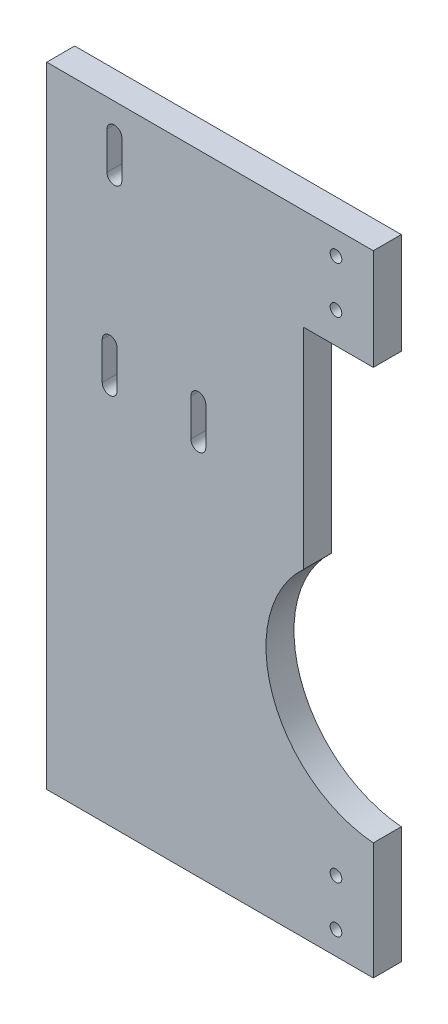
from build123d import *

# Parameters (mm, degrees)
ESQUISSE1_W             = 70
ESQUISSE1_H             = 135
ESQUISSE1_R             = 1.25
BOSS_EXTRU_1_DEPTH      = 6
ENL_V_MAT_EXTRU_2_DEPTH = 153.187384497
ENL_V_MAT_EXTRU_3_DEPTH = 153.187384497


with BuildPart() as part:
    # Esquisse1 → Boss.-Extru.1 (new body)
    with BuildSketch(Plane.XY):
        with Locations((35, 67.5)):
            Rectangle(ESQUISSE1_W, ESQUISSE1_H)
        with Locations((62, 5)):
            Circle(ESQUISSE1_R, mode=Mode.SUBTRACT)
        with Locations((62, 15)):
            Circle(ESQUISSE1_R, mode=Mode.SUBTRACT)
        with Locations(Location((62, 120, 0), (0, 0, 180))):
            Circle(ESQUISSE1_R, mode=Mode.SUBTRACT)
        with Locations(Location((62, 130, 0), (0, 0, 180))):
            Circle(ESQUISSE1_R, mode=Mode.SUBTRACT)
    extrude(amount=BOSS_EXTRU_1_DEPTH)

    # Esquisse3 → Enlèv. mat.-Extru.2 (cut, through all)
    with BuildSketch(Plane.XY.offset(6)):
        with BuildLine():
            Line((70, 25.080128411), (70, 113.33030278))
            Line((70, 113.33030278), (55, 113.33030278))
            Line((55, 113.33030278), (55, 68.33030278))
            ThreePointArc((55, 68.33030278), (48.380211776, 41.80819896), (70, 25.080128411))
        make_face()
    extrude(amount=-ENL_V_MAT_EXTRU_2_DEPTH, mode=Mode.SUBTRACT)

    # Esquisse4 → Enlèv. mat.-Extru.3 (cut, through all)
    with BuildSketch(Plane(origin=(0, 0, 0), x_dir=(-1, 0, 0), z_dir=(0, 0, -1))):
        with BuildLine():
            Line((-12.9, 129), (-12.9, 121))
            ThreePointArc((-12.9, 121), (-14.5, 119.4), (-16.1, 121))
            Line((-16.1, 121), (-16.1, 129))
            ThreePointArc((-16.1, 129), (-14.5, 130.6), (-12.9, 129))
        make_face()
        with BuildLine():
            Line((-11.9, 89.5), (-11.9, 81.5))
            ThreePointArc((-11.9, 81.5), (-13.5, 79.9), (-15.1, 81.5))
            Line((-15.1, 81.5), (-15.1, 89.5))
            ThreePointArc((-15.1, 89.5), (-13.5, 91.1), (-11.9, 89.5))
        make_face()
        with BuildLine():
            Line((-30.9, 88.5), (-30.9, 80.5))
            ThreePointArc((-30.9, 80.5), (-32.5, 78.9), (-34.1, 80.5))
            Line((-34.1, 80.5), (-34.1, 88.5))
            ThreePointArc((-34.1, 88.5), (-32.5, 90.1), (-30.9, 88.5))
        make_face()
    extrude(amount=-ENL_V_MAT_EXTRU_3_DEPTH, mode=Mode.SUBTRACT)


solid = part.part
